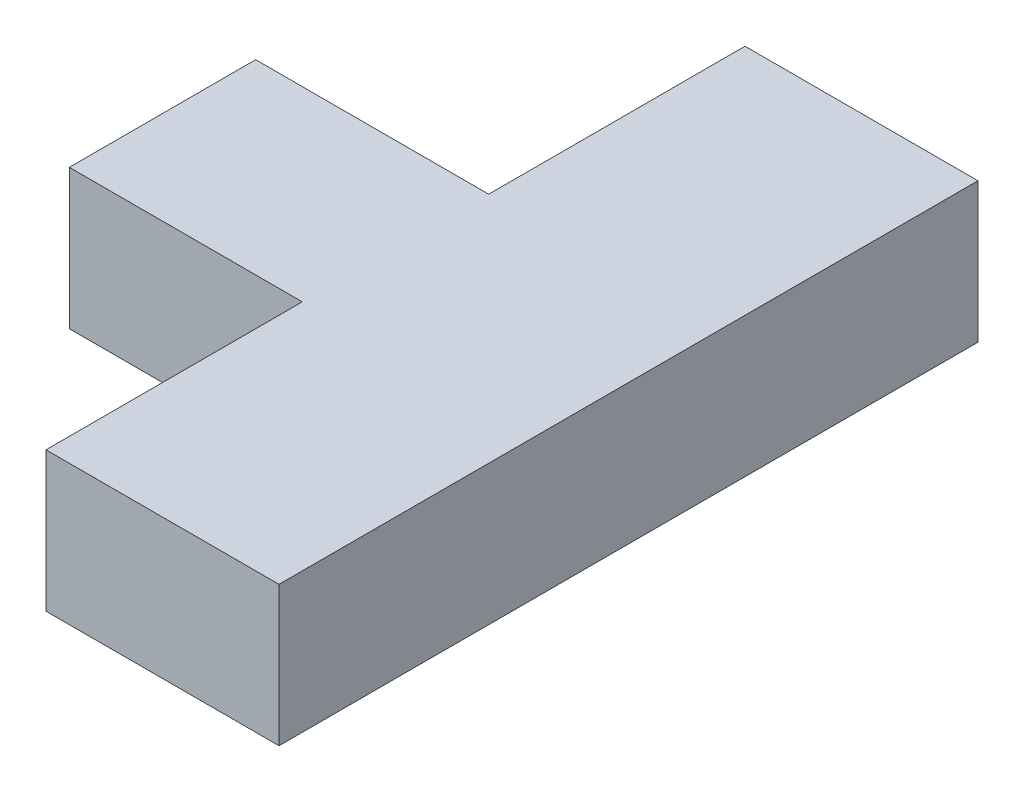
from build123d import *

# Parameters (mm, degrees)
BOSS_EXTRUDE1_DEPTH = 0.3


with BuildPart() as part:
    # Sketch1 → Boss-Extrude1 (new body)
    with BuildSketch(Plane(origin=(0, 0, 0), x_dir=(1, 0, 0), z_dir=(0, 1, 0))):
        Polygon((0, 1.5), (-0.5, 1.5), (-0.5, 0.95), (-1, 0.95), (-1, 0.55), (-0.5, 0.55), (-0.5, 0), (0, 0), align=None)
    extrude(amount=BOSS_EXTRUDE1_DEPTH)


solid = part.part
